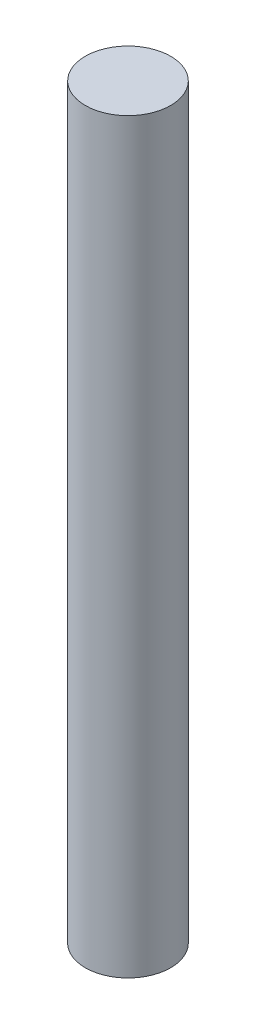
from build123d import *

# Parameters (mm, degrees)
ESQUISSE1_R        = 4
BOSS_EXTRU_1_DEPTH = 35


with BuildPart() as part:
    # Esquisse1 → Boss.-Extru.1 (new, symmetric)
    with BuildSketch(Plane(origin=(0, 0, 0), x_dir=(1, 0, 0), z_dir=(0, 1, 0))):
        with Locations(Location((0, 0, 0), (0, 0, 270))):
            Circle(ESQUISSE1_R)
    extrude(amount=BOSS_EXTRU_1_DEPTH, both=True)


solid = part.part
